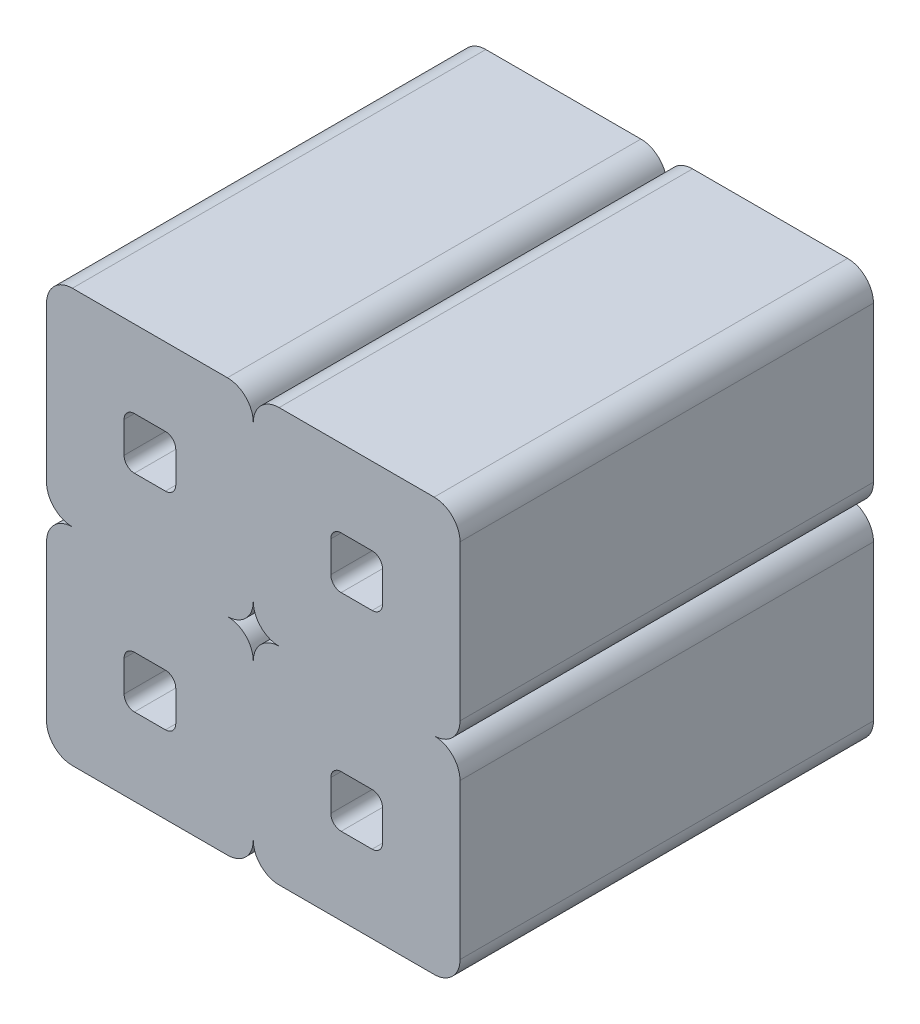
from build123d import *

# Parameters (mm, degrees)
EXTRUDE_1_DEPTH              = 4
PATTERN_LINEAR_2_COUNT       = 2
PATTERN_LINEAR_2_PITCH       = 2
PATTERN_LINEAR_2_COUNT_DIR2  = 2
PATTERN_LINEAR_2_PITCH_DIR2  = 2
EXTRUDE_START                = -1
EXTRUDE_3_DEPTH              = 1.4
PATTERN_LINEAR_11_COUNT      = 2
PATTERN_LINEAR_11_PITCH      = 2
PATTERN_LINEAR_11_COUNT_DIR2 = 2
PATTERN_LINEAR_11_PITCH_DIR2 = 2


with BuildPart() as part:
    # 草图1 → 凸台-拉伸1 (new body)
    with BuildSketch(Plane.XY):
        with BuildLine():
            Line((0.25, 0), (1.75, 0))
            ThreePointArc((1.75, 0), (1.926776695, -0.073223305), (2, -0.25))
            Line((2, -0.25), (2, -1.75))
            ThreePointArc((2, -1.75), (1.926776695, -1.926776695), (1.75, -2))
            Line((1.75, -2), (0.25, -2))
            ThreePointArc((0.25, -2), (0.073223305, -1.926776695), (0, -1.75))
            Line((0, -1.75), (0, -0.25))
            ThreePointArc((0, -0.25), (0.073223305, -0.073223305), (0.25, 0))
        make_face()
        with BuildLine():
            Line((0.85, -0.75), (1.15, -0.75))
            ThreePointArc((1.15, -0.75), (1.220710678, -0.779289322), (1.25, -0.85))
            Line((1.25, -0.85), (1.25, -1.15))
            ThreePointArc((1.25, -1.15), (1.220710678, -1.220710678), (1.15, -1.25))
            Line((1.15, -1.25), (0.85, -1.25))
            ThreePointArc((0.85, -1.25), (0.779289322, -1.220710678), (0.75, -1.15))
            Line((0.75, -1.15), (0.75, -0.85))
            ThreePointArc((0.75, -0.85), (0.779289322, -0.779289322), (0.85, -0.75))
        make_face(mode=Mode.SUBTRACT)
    extrude_1 = extrude(amount=EXTRUDE_1_DEPTH)

    # 阵列(线性)2: Extrude 1 2 × 2
    with Locations(*[(i * PATTERN_LINEAR_2_PITCH, -j * PATTERN_LINEAR_2_PITCH_DIR2, 0) for i in range(PATTERN_LINEAR_2_COUNT) for j in range(PATTERN_LINEAR_2_COUNT_DIR2) if (i, j) != (0, 0)]):
        add(extrude_1)


with BuildPart() as body_2:
    # 草图5 → 凸台-拉伸3 (new body)
    with BuildSketch(Plane(origin=(0, 0, 0), x_dir=(-1, 0, 0), z_dir=(0, 0, -1)).offset(EXTRUDE_START)):
        with BuildLine():
            Line((-0.75, -0.85), (-0.75, -1.15))
            ThreePointArc((-0.75, -1.15), (-0.779289322, -1.220710678), (-0.85, -1.25))
            Line((-0.85, -1.25), (-1.15, -1.25))
            ThreePointArc((-1.15, -1.25), (-1.220710678, -1.220710678), (-1.25, -1.15))
            Line((-1.25, -1.15), (-1.25, -0.85))
            ThreePointArc((-1.25, -0.85), (-1.220710678, -0.779289322), (-1.15, -0.75))
            Line((-1.15, -0.75), (-0.85, -0.75))
            ThreePointArc((-0.85, -0.75), (-0.779289322, -0.779289322), (-0.75, -0.85))
        make_face()
    extrude_3 = extrude(amount=EXTRUDE_3_DEPTH)


with BuildPart() as part_1:
    add(part.part)

    # 阵列(线性)11: Extrude 3 2 × 2
    with Locations(*[(i * PATTERN_LINEAR_11_PITCH, -j * PATTERN_LINEAR_11_PITCH_DIR2, 0) for i in range(PATTERN_LINEAR_11_COUNT) for j in range(PATTERN_LINEAR_11_COUNT_DIR2) if (i, j) != (0, 0)]):
        add(extrude_3)


solid = Compound([body_2.part, part_1.part])
